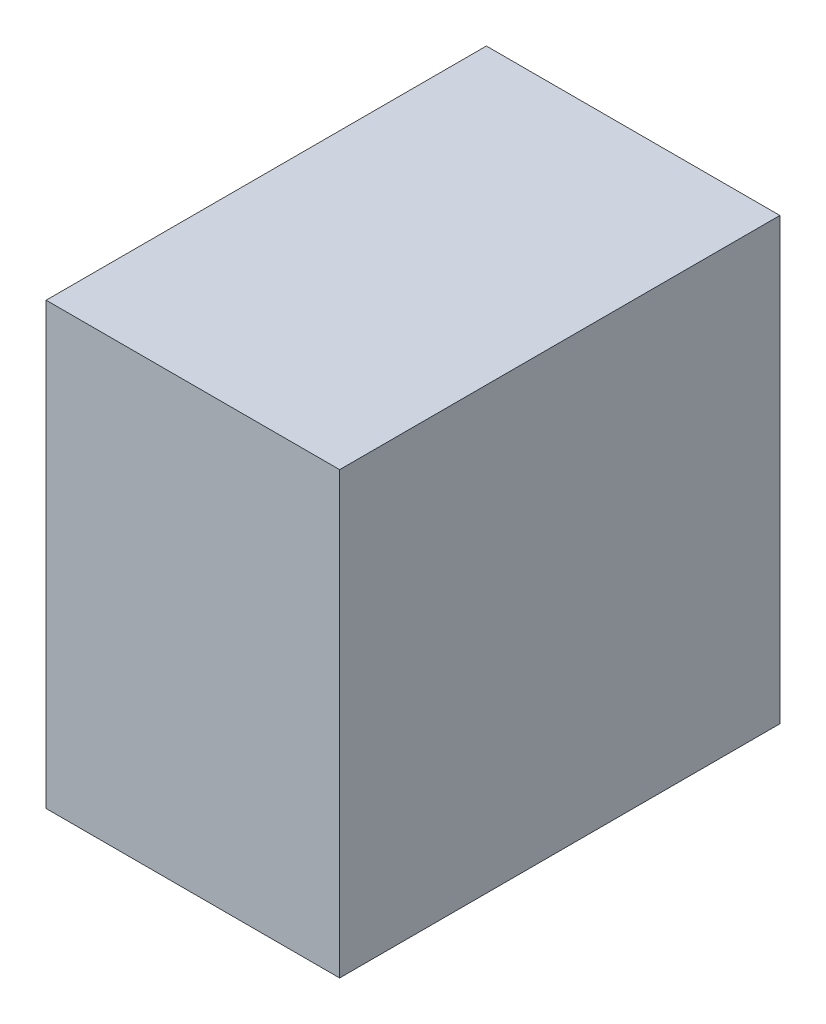
from build123d import *

# Parameters (mm, degrees)
SKETCH1_W           = 30
SKETCH1_H           = 30
BOSS_EXTRUDE1_DEPTH = 10


with BuildPart() as part:
    # Sketch1 → Boss-Extrude1 (new, symmetric)
    with BuildSketch(Plane(origin=(0, 0, 0), x_dir=(0, 0, -1), z_dir=(1, 0, 0))):
        Rectangle(SKETCH1_W, SKETCH1_H)
    extrude(amount=BOSS_EXTRUDE1_DEPTH, both=True)


solid = part.part
